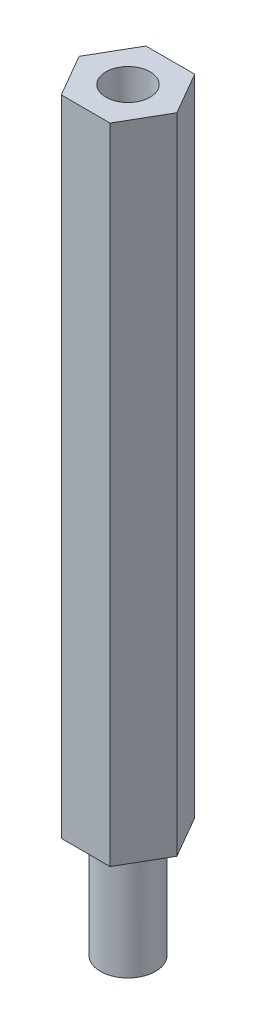
from build123d import *

# Parameters (mm, degrees)
SKETCH1_R           = 1.2
BOSS_EXTRUDE1_DEPTH = 35
SKETCH3_R           = 1.5
BOSS_EXTRUDE2_DEPTH = 6


with BuildPart() as part:
    # Sketch1 → Boss-Extrude1 (new body)
    with BuildSketch(Plane(origin=(0, 0, 0), x_dir=(1, 0, 0), z_dir=(0, 1, 0))):
        Polygon((2.655811238, 0), (1.327905619, 2.3), (-1.327905619, 2.3), (-2.655811238, 0), (-1.327905619, -2.3), (1.327905619, -2.3), align=None)
        with Locations(Location((0, 0, 0), (0, 0, 270))):
            Circle(SKETCH1_R, mode=Mode.SUBTRACT)
    extrude(amount=BOSS_EXTRUDE1_DEPTH)

    # Sketch3 → Boss-Extrude2 (add)
    with BuildSketch(Plane(origin=(0, 0, 0), x_dir=(-1, 0, 0), z_dir=(0, -1, 0))):
        with Locations(Location((0, 0, 0), (0, 0, 270))):
            Circle(SKETCH3_R)
    extrude(amount=BOSS_EXTRUDE2_DEPTH)


solid = part.part
